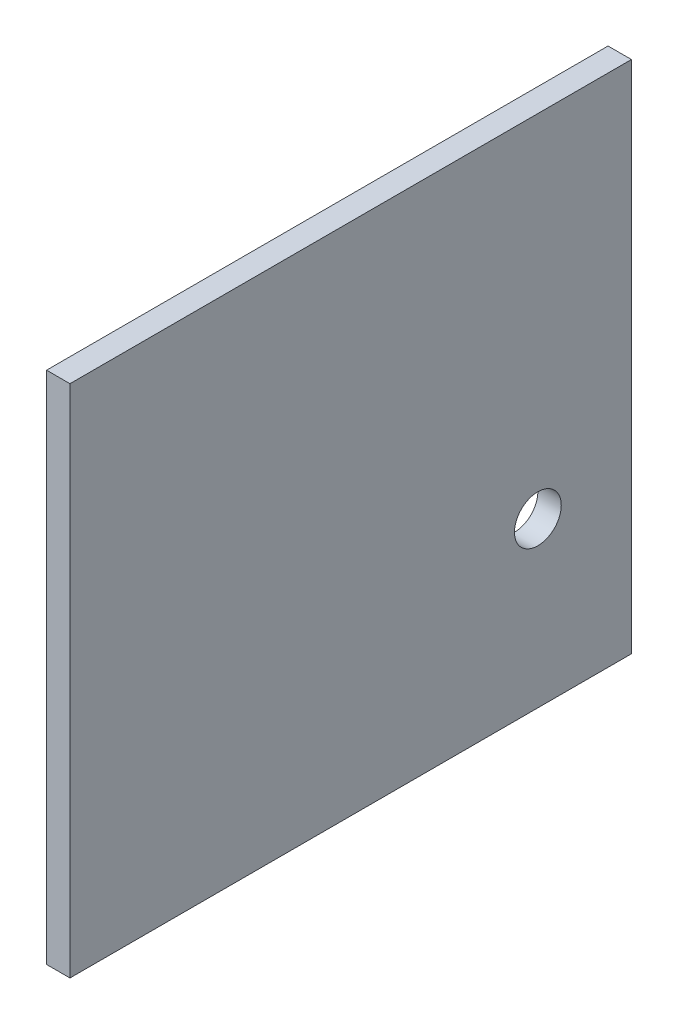
from build123d import *

# Parameters (mm, degrees)
SKETCH1_W           = 120
SKETCH1_H           = 110
BOSS_EXTRUDE1_DEPTH = 5
SKETCH2_R           = 5
CUT_EXTRUDE1_DEPTH  = 82.547532152


with BuildPart() as part:
    # Sketch1 → Boss-Extrude1 (new body)
    with BuildSketch(Plane(origin=(0, 0, 0), x_dir=(0, 0, -1), z_dir=(1, 0, 0))):
        Rectangle(SKETCH1_W, SKETCH1_H)
    extrude(amount=BOSS_EXTRUDE1_DEPTH)

    # Sketch2 → Cut-Extrude1 (cut, through all)
    with BuildSketch(Plane(origin=(5, 0, 0), x_dir=(0, 0, -1), z_dir=(1, 0, 0))):
        with Locations((40, -20)):
            Circle(SKETCH2_R)
    extrude(amount=-CUT_EXTRUDE1_DEPTH, mode=Mode.SUBTRACT)


solid = part.part
